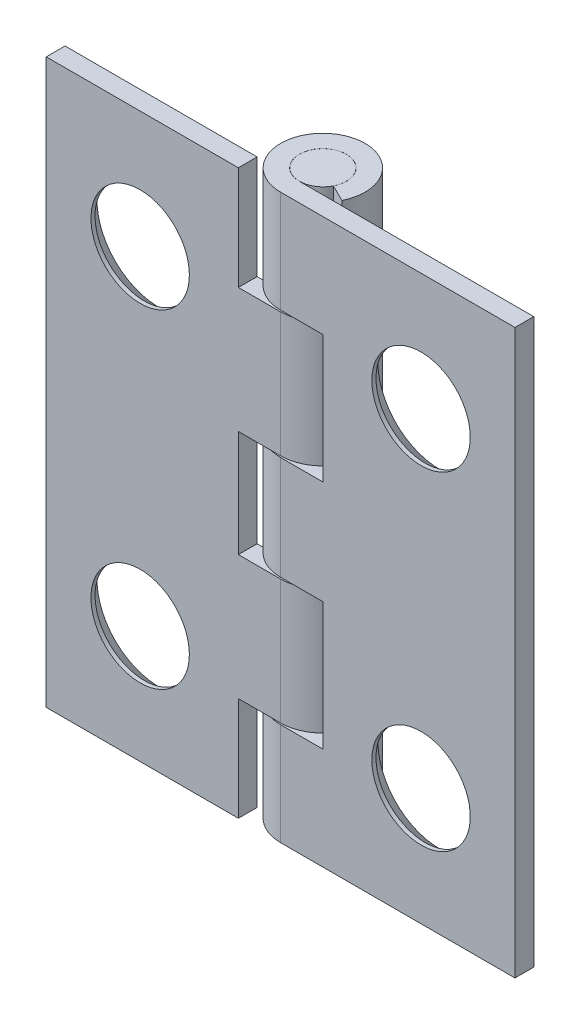
from build123d import *

# Parameters (mm, degrees)
EXTRUDE1_DEPTH          = 9.525
LPATTERN2_COUNT         = 2
LPATTERN2_PITCH         = 11.1125
CUT_EXTRUDE1_DEPTH      = 13.472746554
CUT_EXTRUDE1_DEPTH_BACK = 13.472746554
SKETCH4_W               = 2.8575
SKETCH4_H               = 4.318
CUT_EXTRUDE2_DEPTH      = 13.472746554
CUT_EXTRUDE2_DEPTH_BACK = 13.472746554
SKETCH5_W               = 2.8575
SKETCH5_H               = 3.5052
SKETCH5_H_2             = 3.6068
EXTRUDE2_START          = -9.525
SKETCH6_R               = 0.79121
EXTRUDE2_DEPTH          = 19.05


with BuildPart() as part:
    # Sketch1 → Extrude1 (new, symmetric)
    with BuildSketch(Plane(origin=(0, 0, 0), x_dir=(1, 0, 0), z_dir=(0, 1, 0))):
        with BuildLine():
            Line((0, -0.79375), (7.9248, -0.79375))
            Line((7.9248, -0.79375), (7.9248, -1.42875))
            Line((7.9248, -1.42875), (0, -1.42875))
            ThreePointArc((0, -1.42875), (-0.753017368, 1.214204022), (1.279883418, -0.635))
            Line((1.279883418, -0.635), (0.711046343, -0.352777778))
            ThreePointArc((0.711046343, -0.352777778), (-0.418342982, 0.67455779), (0, -0.79375))
        make_face()
    extrude(amount=EXTRUDE1_DEPTH, both=True)

    # Sketch7 → Cut-Revolve1 (revolve, cut)
    with BuildSketch(Plane(origin=(4.7498, 0, 0), x_dir=(0, 0, -1), z_dir=(1, 0, 0)), mode=Mode.PRIVATE) as cut_revolve1_sk:
        Polygon((-0.79375, 5.55625), (-0.79375, 7.65175), (-1.290479078, 7.21995), (-1.42875, 7.21995), (-1.42875, 5.55625), align=None)
    cut_revolve1 = revolve(cut_revolve1_sk.sketch.rotate(Axis((4.7498, 5.55625, -1.822321443), (0, 0, 1)), 90), axis=Axis((4.7498, 5.55625, -1.822321443), (0, 0, 1)), mode=Mode.SUBTRACT)

    # LPattern2: Cut-Revolve1 ×2
    with Locations(*[(0, -i * LPATTERN2_PITCH, 0) for i in range(1, LPATTERN2_COUNT)]):
        add(cut_revolve1, mode=Mode.SUBTRACT)


with BuildPart() as body_2:
    # Mirror2: mirrored copy
    add(part.part.mirror(Plane(origin=(0, 0, 0), x_dir=(0, 0, 1), z_dir=(1, 0, 0))))

    # Sketch5 → Cut-Extrude2 (cut, two sides: drawn at the far end of the back side and taken through both)
    with BuildSketch(Plane.XY.offset(-CUT_EXTRUDE2_DEPTH_BACK)):
        with Locations((0, -7.7724)):
            Rectangle(SKETCH5_W, SKETCH5_H)
        Rectangle(SKETCH5_W, SKETCH5_H_2)
        with Locations((0, 7.7724)):
            Rectangle(SKETCH5_W, SKETCH5_H)
    extrude(amount=CUT_EXTRUDE2_DEPTH + CUT_EXTRUDE2_DEPTH_BACK, mode=Mode.SUBTRACT)


with BuildPart() as part_1:
    add(part.part)

    # Sketch4 → Cut-Extrude1 (cut, two sides: drawn at the far end of the back side and taken through both)
    with BuildSketch(Plane.XY.offset(-CUT_EXTRUDE1_DEPTH_BACK)):
        with Locations((0, 3.9116)):
            Rectangle(SKETCH4_W, SKETCH4_H)
        with Locations((0, -3.9116)):
            Rectangle(SKETCH4_W, SKETCH4_H)
    extrude(amount=CUT_EXTRUDE1_DEPTH + CUT_EXTRUDE1_DEPTH_BACK, mode=Mode.SUBTRACT)


with BuildPart() as body_3:
    # Sketch6 → Extrude2 (new body)
    with BuildSketch(Plane(origin=(0, 0, 0), x_dir=(1, 0, 0), z_dir=(0, 1, 0)).offset(EXTRUDE2_START)):
        with Locations(Location((0, 0, 0), (0, 0, 270))):
            Circle(SKETCH6_R)
    extrude(amount=EXTRUDE2_DEPTH)


solid = Compound([body_2.part, part_1.part, body_3.part])
